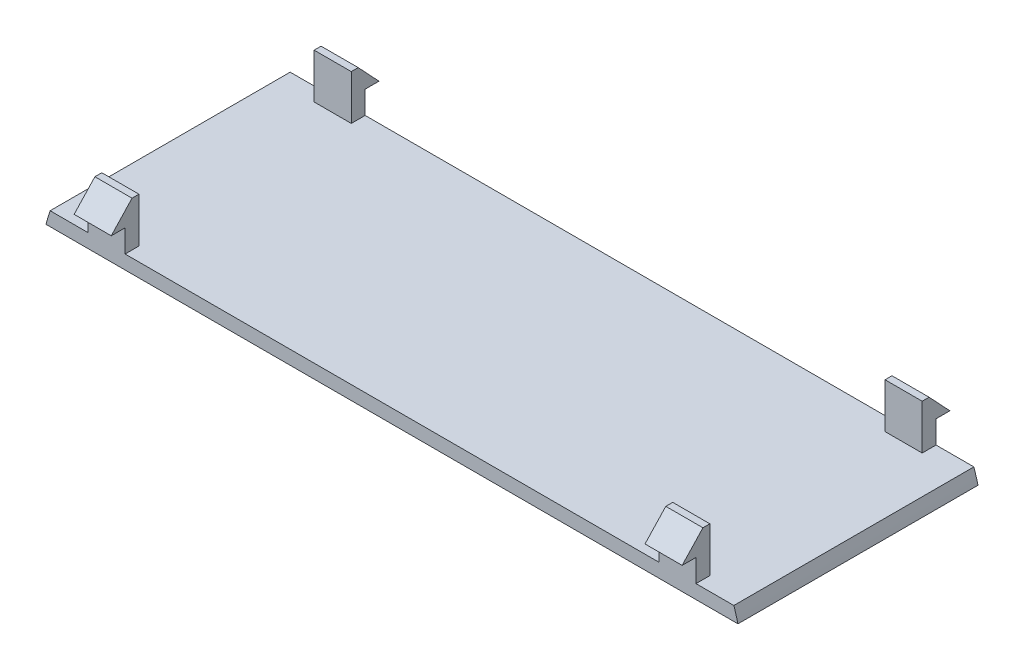
from build123d import *

# Parameters (mm, degrees)
BOSS_EXTRUDE1_DEPTH  = 27.5
BOSS_EXTRUDE2_DEPTH  = 4.2545
LPATTERN2_COUNT      = 2
LPATTERN2_PITCH      = 65.405
MIRROR2_COPY_1_DEPTH = 4.2545


with BuildPart() as part:
    # Sketch1 → Boss-Extrude1 (new body)
    with BuildSketch(Plane.XY):
        with BuildLine():
            Line((0, 0), (-79.276260795, 0))
            ThreePointArc((-79.276260795, 0), (-79.053846694, 0.797858902), (-78.803819102, 1.5875))
            Line((-78.803819102, 1.5875), (-0.472441693, 1.5875))
            ThreePointArc((-0.472441693, 1.5875), (-0.222414101, 0.797858902), (0, 0))
        make_face()
    extrude(amount=BOSS_EXTRUDE1_DEPTH)

    # 3DSketch1 → Boss-Extrude2 (add)
    with BuildSketch(Plane(origin=(-4.808380397, 1.5875, 27.5), x_dir=(0, 0.9555235878955425, -0.2949146876220808), z_dir=(1, 0, 0))):
        Polygon((0, 0), (2.487705661, 0.767810389), (2.019528594, 2.284704085), (5.148824108, 0.758446848), (5.382912641, 0), (0.468177067, -1.516893696), align=None)
    boss_extrude2 = extrude(amount=-BOSS_EXTRUDE2_DEPTH)

    # LPattern2: Boss-Extrude2 ×2
    with Locations(*[(-i * LPATTERN2_PITCH, 0, 0) for i in range(1, LPATTERN2_COUNT)]):
        add(boss_extrude2)

    # Mirror2: Boss-Extrude2 across plane
    add(boss_extrude2.mirror(Plane.XY.offset(13.750000068)))

    # Mirror2 copy 1 sketch → Mirror2 copy 1 (add)
    with BuildSketch(Plane(origin=(-70.213380397, 1.5875, 1.36e-07), x_dir=(0, 0.9555235878955425, 0.2949146876220808), z_dir=(1, 0, 0))):
        Polygon((0, 0), (2.487705661, -0.767810389), (2.019528594, -2.284704085), (5.148824108, -0.758446848), (5.382912641, 0), (0.468177067, 1.516893696), align=None)
    extrude(amount=-MIRROR2_COPY_1_DEPTH)


solid = part.part
